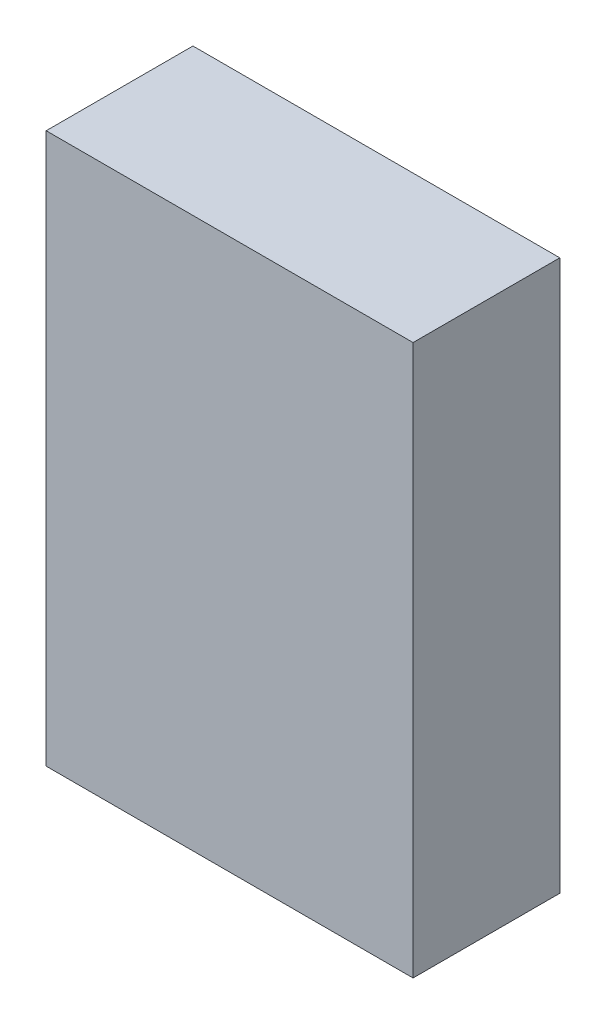
from build123d import *

# Parameters (mm, degrees)
SKETCH1_W           = 25.4
SKETCH1_H           = 38.1
BOSS_EXTRUDE1_DEPTH = 10.16
SKETCH2_R           = 1.905
CUT_EXTRUDE1_DEPTH  = 10.16


with BuildPart() as part:
    # Sketch1 → Boss-Extrude1 (new body)
    with BuildSketch(Plane.XY):
        with Locations((12.7, 19.05)):
            Rectangle(SKETCH1_W, SKETCH1_H)
    extrude(amount=BOSS_EXTRUDE1_DEPTH)

    # Sketch2 → Cut-Extrude1 (cut)
    with BuildSketch(Plane.ZY):
        with Locations((5.130709773, 30.48)):
            Circle(SKETCH2_R)
        with Locations((5.130709773, 7.62)):
            Circle(SKETCH2_R)
    extrude(amount=-CUT_EXTRUDE1_DEPTH, mode=Mode.SUBTRACT)


solid = part.part
